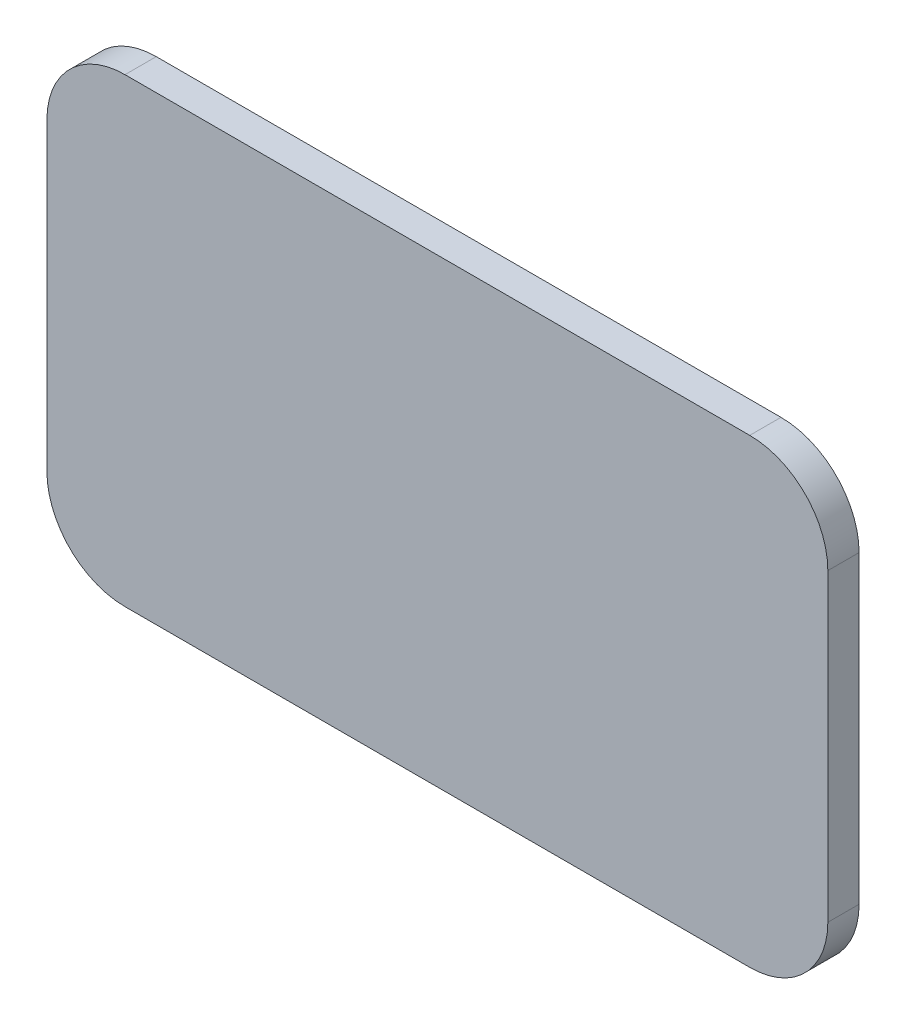
from build123d import *

# Parameters (mm, degrees)
SKETCH1_W           = 92
SKETCH1_H           = 51
BOSS_EXTRUDE1_DEPTH = 2
FILLET1_R           = 6
BOSS_EXTRUDE2_DEPTH = 4
BOSS_EXTRUDE3_DEPTH = 10
CUT_EXTRUDE2_START  = -2
CUT_EXTRUDE2_DEPTH  = 2


with BuildPart() as part:
    # Sketch1 → Boss-Extrude1 (new body)
    with BuildSketch(Plane.XY):
        Rectangle(SKETCH1_W, SKETCH1_H)
    extrude(amount=BOSS_EXTRUDE1_DEPTH)

    # Fillet1
    fillet1_edges = [part.edges().sort_by_distance(p)[0] for p in [
        (46, -25.5, 1),
        (-46, -25.5, 1),
        (-46, 25.5, 1),
        (46, 25.5, 1),
    ]]
    fillet(fillet1_edges, radius=FILLET1_R)

    # Sketch2 → Boss-Extrude2 (add)
    with BuildSketch(Plane.XY.offset(2)):
        with BuildLine():
            Line((-40, -29.5), (40, -29.5))
            ThreePointArc((40, -29.5), (47.071067812, -26.571067812), (50, -19.5))
            Line((50, -19.5), (50, 19.5))
            ThreePointArc((50, 19.5), (47.071067812, 26.571067812), (40, 29.5))
            Line((40, 29.5), (-40, 29.5))
            ThreePointArc((-40, 29.5), (-47.071067812, 26.571067812), (-50, 19.5))
            Line((-50, 19.5), (-50, -19.5))
            ThreePointArc((-50, -19.5), (-47.071067812, -26.571067812), (-40, -29.5))
        make_face()
        with BuildLine():
            Line((-46, 19.5), (-46, -19.5))
            ThreePointArc((-46, -19.5), (-44.242640687, -23.742640687), (-40, -25.5))
            Line((-40, -25.5), (40, -25.5))
            ThreePointArc((40, -25.5), (44.242640687, -23.742640687), (46, -19.5))
            Line((46, -19.5), (46, 19.5))
            ThreePointArc((46, 19.5), (44.242640687, 23.742640687), (40, 25.5))
            Line((40, 25.5), (-40, 25.5))
            ThreePointArc((-40, 25.5), (-44.242640687, 23.742640687), (-46, 19.5))
        make_face(mode=Mode.SUBTRACT)
    extrude(amount=-BOSS_EXTRUDE2_DEPTH)

    # Sketch3 → Boss-Extrude3 (add, symmetric)
    with BuildSketch(Plane(origin=(0, 0, 0), x_dir=(1, 0, 0), z_dir=(0, 1, 0))):
        with BuildLine():
            Line((-41, 7.6), (-41, 0))
            Line((-41, 0), (-38, 0))
            Line((-38, 0), (-38, 10))
            Line((-38, 10), (-39.799999994, 10))
            ThreePointArc((-39.799999994, 10), (-41.141640785, 9.170820396), (-41, 7.6))
        make_face()
        with BuildLine():
            Line((38, 0), (41, 0))
            Line((41, 0), (41, 7.6))
            ThreePointArc((41, 7.6), (41.141640788, 9.17082039), (39.800000006, 10))
            Line((39.800000006, 10), (38, 10))
            Line((38, 10), (38, 0))
        make_face()
    extrude(amount=BOSS_EXTRUDE3_DEPTH, both=True)

    # Sketch4 → Cut-Extrude2 (cut)
    with BuildSketch(Plane(origin=(0, 0, -2), x_dir=(-1, 0, 0), z_dir=(0, 0, -1)).offset(CUT_EXTRUDE2_START)):
        with BuildLine():
            Line((46.1, -19.5), (46.1, 19.5))
            ThreePointArc((46.1, 19.5), (44.313351365, 23.813351365), (40, 25.6))
            Line((40, 25.6), (-40, 25.6))
            ThreePointArc((-40, 25.6), (-44.313351365, 23.813351365), (-46.1, 19.5))
            Line((-46.1, 19.5), (-46.1, -19.5))
            ThreePointArc((-46.1, -19.5), (-44.313351365, -23.813351365), (-40, -25.6))
            Line((-40, -25.6), (40, -25.6))
            ThreePointArc((40, -25.6), (44.313351365, -23.813351365), (46.1, -19.5))
        make_face()
        with BuildLine():
            Line((-40, 25.5), (40, 25.5))
            ThreePointArc((40, 25.5), (44.242640687, 23.742640687), (46, 19.5))
            Line((46, 19.5), (46, -19.5))
            ThreePointArc((46, -19.5), (44.242640687, -23.742640687), (40, -25.5))
            Line((40, -25.5), (-40, -25.5))
            ThreePointArc((-40, -25.5), (-44.242640687, -23.742640687), (-46, -19.5))
            Line((-46, -19.5), (-46, 19.5))
            ThreePointArc((-46, 19.5), (-44.242640687, 23.742640687), (-40, 25.5))
        make_face(mode=Mode.SUBTRACT)
    extrude(amount=CUT_EXTRUDE2_DEPTH, mode=Mode.SUBTRACT)


solid = part.part
